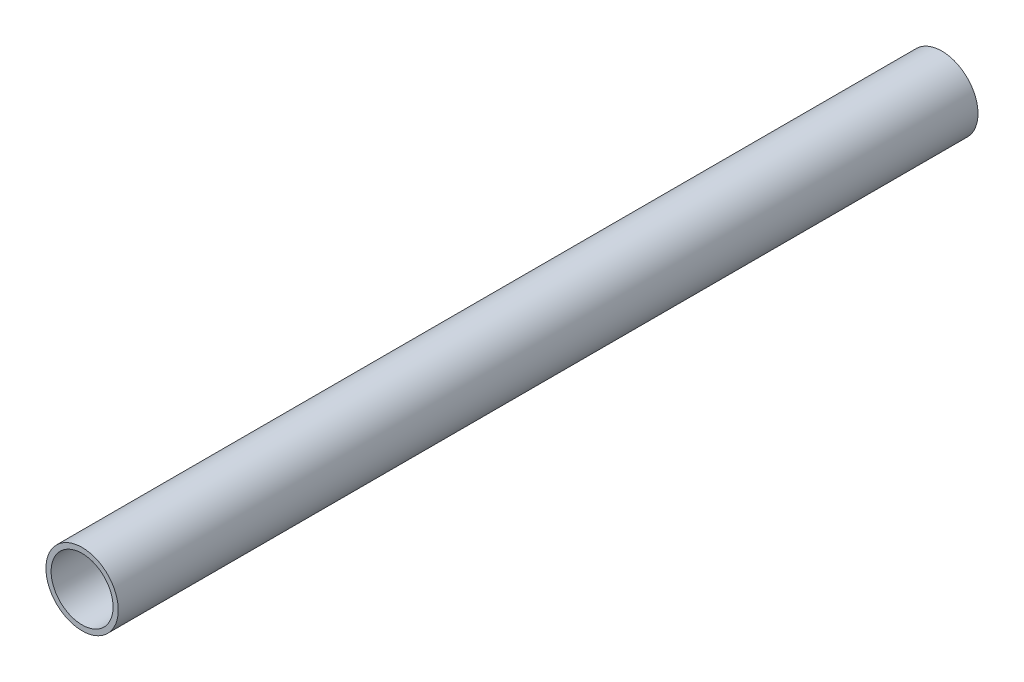
from build123d import *

# Parameters (mm, degrees)
SKETCH1_R           = 11.1125
SKETCH1_R_2         = 9.525
BOSS_EXTRUDE1_DEPTH = 132.107958542


with BuildPart() as part:
    # Sketch1 → Boss-Extrude1 (new, symmetric)
    with BuildSketch(Plane.XY):
        Circle(SKETCH1_R)
        Circle(SKETCH1_R_2, mode=Mode.SUBTRACT)
    extrude(amount=BOSS_EXTRUDE1_DEPTH, both=True)


solid = part.part
